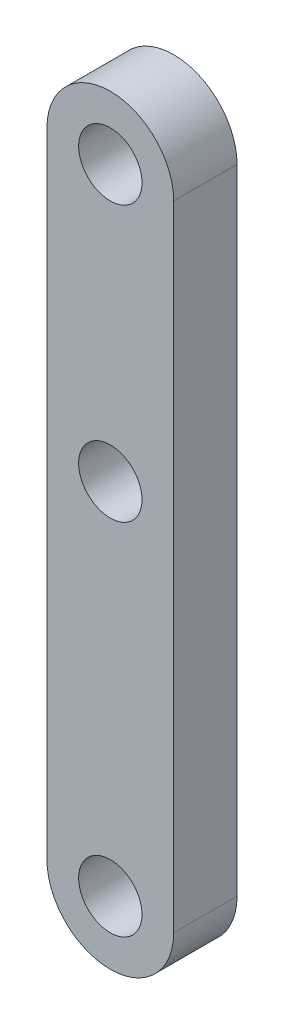
from build123d import *

# Parameters (mm, degrees)
SKETCH_1_R      = 1.5
EXTRUDE_1_DEPTH = 3


with BuildPart() as part:
    # ｽｹｯﾁ1 → ﾎﾞｽ - 押し出し1 (new body)
    with BuildSketch(Plane.XY):
        with BuildLine():
            Line((-3, 0), (-3, -30))
            ThreePointArc((-3, -30), (0, -33), (3, -30))
            Line((3, -30), (3, -12))
            Line((3, -12), (3, -8))
            Line((3, -8), (3, 0))
            ThreePointArc((3, 0), (0, 3), (-3, 0))
        make_face()
        Circle(SKETCH_1_R, mode=Mode.SUBTRACT)
        with Locations(Location((0, -30, 0), (0, 0, 180))):
            Circle(SKETCH_1_R, mode=Mode.SUBTRACT)
        with Locations((0, -13)):
            Circle(SKETCH_1_R, mode=Mode.SUBTRACT)
    extrude(amount=EXTRUDE_1_DEPTH)


solid = part.part
